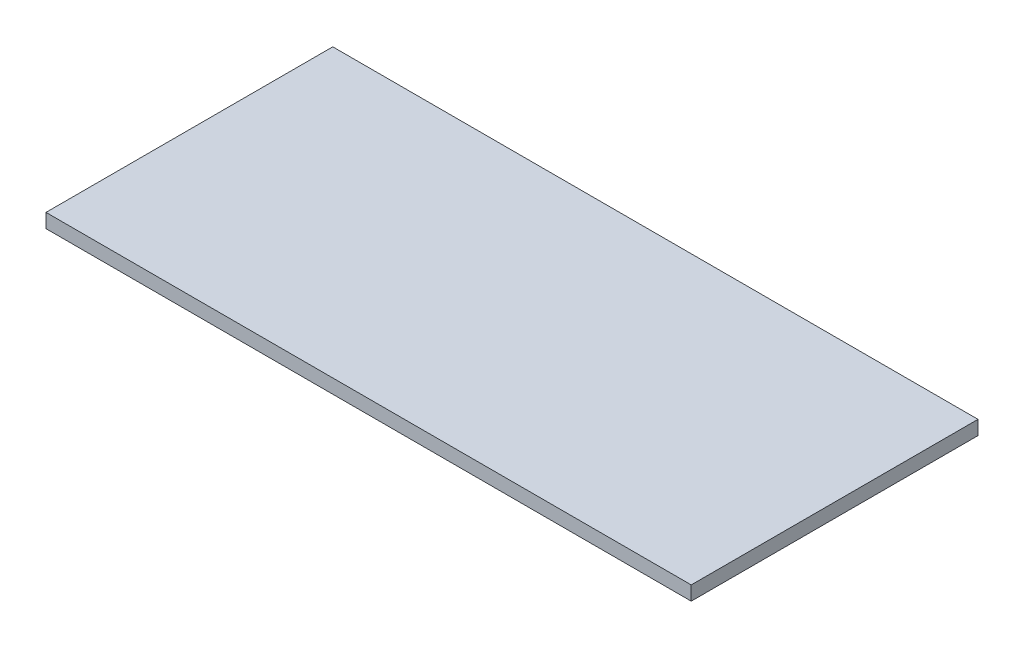
from build123d import *

# Parameters (mm, degrees)
SKETCH1_W           = 228.6
SKETCH1_H           = 101.6
BOSS_EXTRUDE1_DEPTH = 5


with BuildPart() as part:
    # Sketch1 → Boss-Extrude1 (new body)
    with BuildSketch(Plane(origin=(0, 0, 0), x_dir=(1, 0, 0), z_dir=(0, 1, 0))):
        Rectangle(SKETCH1_W, SKETCH1_H)
    extrude(amount=BOSS_EXTRUDE1_DEPTH)


solid = part.part
